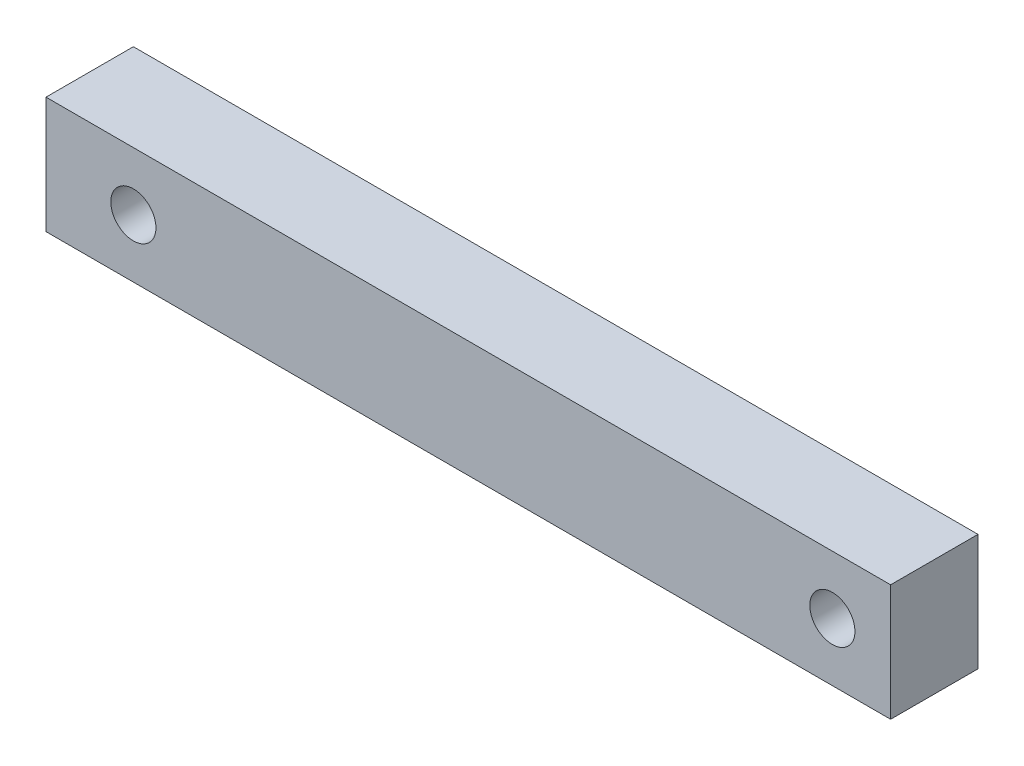
from build123d import *

# Parameters (mm, degrees)
SZKIC1_W                    = 58
SZKIC1_H                    = 8
DODANIE_WYCI_GNI_CIE1_DEPTH = 6
SZKIC2_R                    = 1.55
WYTNIJ_WYCI_GNI_CIE1_DEPTH  = 6


with BuildPart() as part:
    # Szkic1 → Dodanie-wyciągnięcie1 (new body)
    with BuildSketch(Plane.XY):
        with Locations((64, -370.619505632)):
            Rectangle(SZKIC1_W, SZKIC1_H)
    extrude(amount=DODANIE_WYCI_GNI_CIE1_DEPTH)

    # Szkic2 → Wytnij-wyciągnięcie1 (cut)
    with BuildSketch(Plane(origin=(0, 0, 0), x_dir=(-1, 0, 0), z_dir=(0, 0, -1))):
        with Locations((-89, -370.619505632)):
            Circle(SZKIC2_R)
        with Locations((-41, -370.619505632)):
            Circle(SZKIC2_R)
    extrude(amount=-WYTNIJ_WYCI_GNI_CIE1_DEPTH, mode=Mode.SUBTRACT)


solid = part.part
